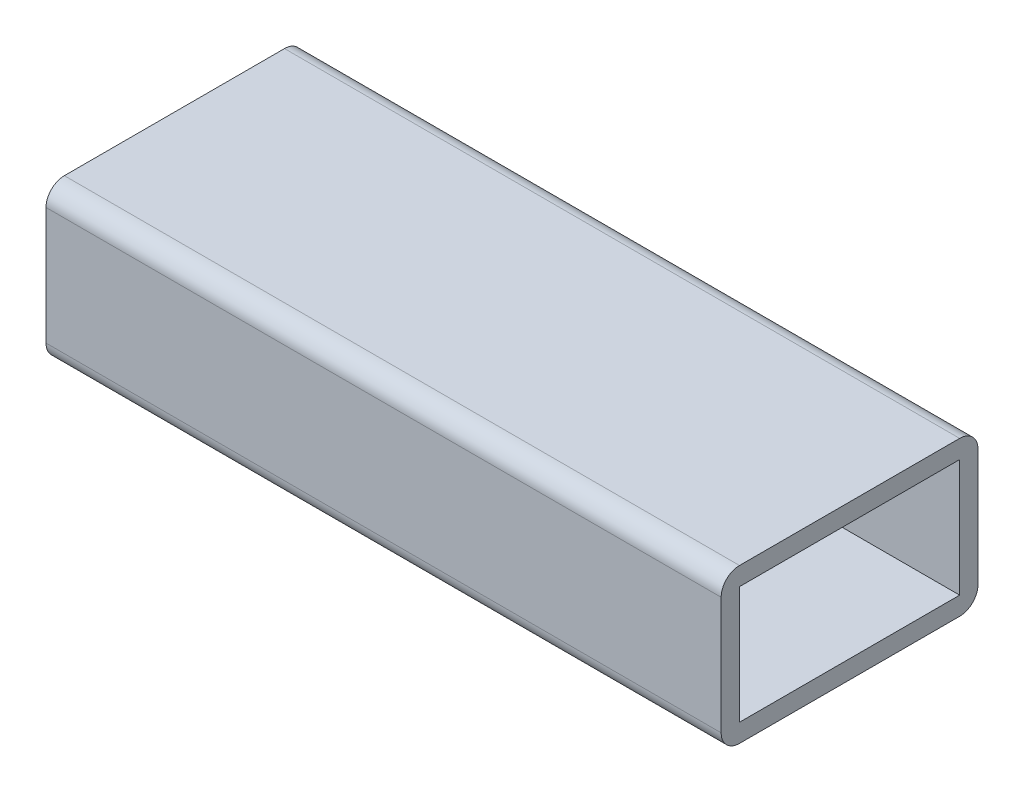
from build123d import *

# Parameters (mm, degrees)
SKETCH_1_W      = 3.5
SKETCH_1_H      = 2.1
SKETCH_1_W_2    = 3
SKETCH_1_H_2    = 1.6
EXTRUDE_1_DEPTH = 9.2
FILLET_1_R      = 0.25


with BuildPart() as part:
    # 草图1 → 凸台-拉伸1 (new body)
    with BuildSketch(Plane(origin=(0, 0, 0), x_dir=(0, 0, -1), z_dir=(1, 0, 0))):
        Rectangle(SKETCH_1_W, SKETCH_1_H)
        Rectangle(SKETCH_1_W_2, SKETCH_1_H_2, mode=Mode.SUBTRACT)
    extrude(amount=EXTRUDE_1_DEPTH)

    # 圆角1
    fillet_1_edges = [part.edges().sort_by_distance(p)[0] for p in [
        (4.6, -1.05, 1.75),
        (4.6, 1.05, 1.75),
        (4.6, 1.05, -1.75),
        (4.6, -1.05, -1.75),
    ]]
    fillet(fillet_1_edges, radius=FILLET_1_R)


solid = part.part
